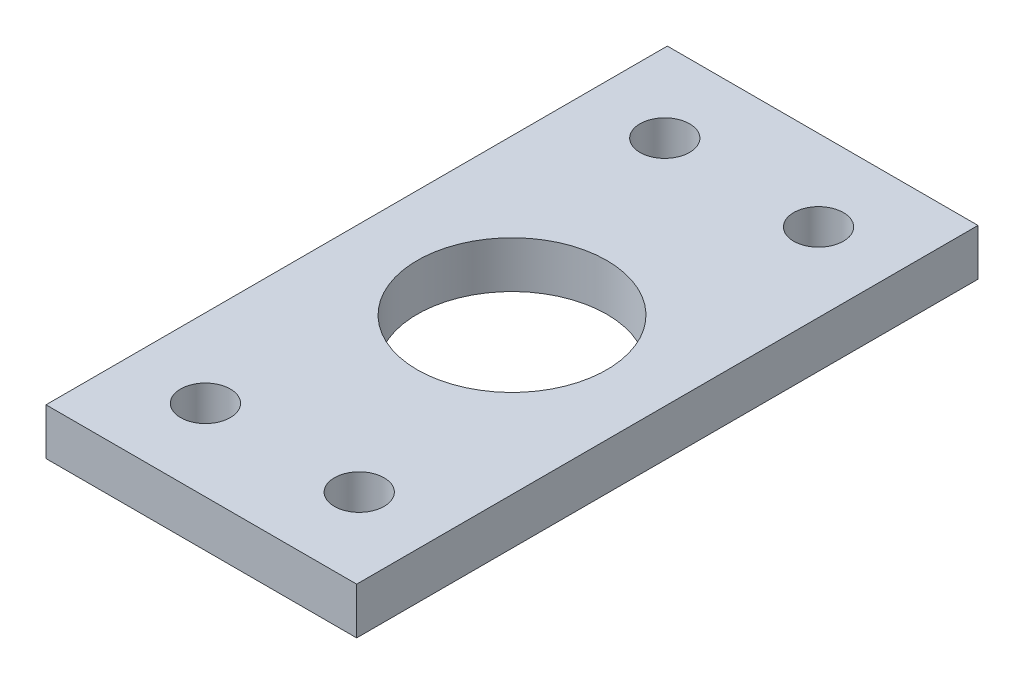
from build123d import *

# Parameters (mm, degrees)
SKETCH_1_W      = 20
SKETCH_1_H      = 40
SKETCH_1_R      = 6.1
SKETCH_1_R_2    = 1.6
EXTRUDE_1_DEPTH = 3


with BuildPart() as part:
    # 草图1 → 凸台-拉伸1 (new body)
    with BuildSketch(Plane(origin=(0, 0, 0), x_dir=(1, 0, 0), z_dir=(0, 1, 0))):
        Rectangle(SKETCH_1_W, SKETCH_1_H)
        with Locations(Location((0, 0, 0), (0, 0, 270))):
            Circle(SKETCH_1_R, mode=Mode.SUBTRACT)
        with Locations(Location((4.95, 14.785, 0), (0, 0, 270))):
            Circle(SKETCH_1_R_2, mode=Mode.SUBTRACT)
        with Locations(Location((4.95, -14.785, 0), (0, 0, 90))):
            Circle(SKETCH_1_R_2, mode=Mode.SUBTRACT)
        with Locations(Location((-4.95, 14.785, 0), (0, 0, 90))):
            Circle(SKETCH_1_R_2, mode=Mode.SUBTRACT)
        with Locations(Location((-4.95, -14.785, 0), (0, 0, 270))):
            Circle(SKETCH_1_R_2, mode=Mode.SUBTRACT)
    extrude(amount=EXTRUDE_1_DEPTH)


solid = part.part
